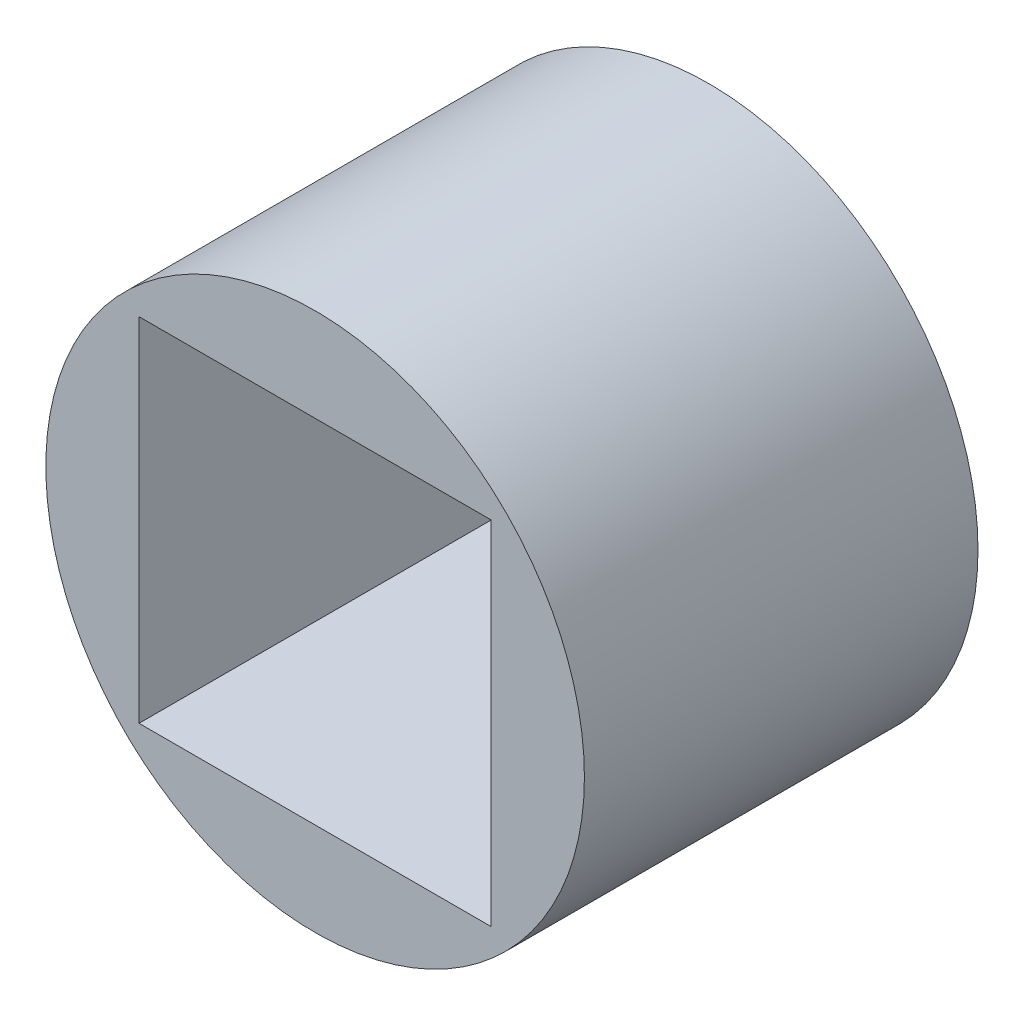
from build123d import *

# Parameters (mm, degrees)
SKETCH1_R           = 13
BOSS_EXTRUDE1_DEPTH = 19
SKETCH2_W           = 17
SKETCH2_H           = 17
CUT_EXTRUDE1_DEPTH  = 27.438608133
SKETCH3_W           = 1.141769493
SKETCH3_H           = 0.590570428
CUT_EXTRUDE2_DEPTH  = 0.25


with BuildPart() as part:
    # Sketch1 → Boss-Extrude1 (new body)
    with BuildSketch(Plane.XY):
        Circle(SKETCH1_R)
    extrude(amount=BOSS_EXTRUDE1_DEPTH)

    # Sketch2 → Cut-Extrude1 (cut, through all)
    with BuildSketch(Plane(origin=(0, 0, 0), x_dir=(-1, 0, 0), z_dir=(0, 0, -1))):
        Rectangle(SKETCH2_W, SKETCH2_H)
    extrude(amount=-CUT_EXTRUDE1_DEPTH, mode=Mode.SUBTRACT)

    # Sketch3 → Cut-Extrude2 (cut)
    with BuildSketch(Plane.XZ.offset(-8.5)):
        with BuildLine():
            Line((-2.812211455, 9.352253877), (-3.678381415, 9.352253877))
            Line((-3.678381415, 9.352253877), (-3.678381415, 9.924368978))
            add(Edge.make_bspline(
                [(-3.678381415, 9.924368978), (-3.678531304, 9.944055381), (-3.678817059, 9.981586333), (-3.680082779, 10.035112211), (-3.681725695, 10.082915251), (-3.684529025, 10.124815355), (-3.689270054, 10.1606206), (-3.692992529, 10.190736926), (-3.698401464, 10.215115406), (-3.706958569, 10.239256452), (-3.722517978, 10.263663704), (-3.750721307, 10.284102994), (-3.787249356, 10.295639991), (-3.814042513, 10.296631897), (-3.828484732, 10.29716656)],
                knots=[0, 0, 0, 0, 1.544726687, 2.944929139, 4.200879413, 5.297955196, 6.23794902, 7.034364875, 7.678368203, 8.192494392, 9.040394705, 9.90282632, 10.869568031, 12, 12, 12, 12], degree=3))
            add(Edge.make_bspline(
                [(-3.828484732, 10.29716656), (-3.844843187, 10.296443751), (-3.875090504, 10.295107254), (-3.915764589, 10.27983069), (-3.947883788, 10.255006405), (-3.963455792, 10.224349752), (-3.9719829, 10.195107964), (-3.978045208, 10.166938862), (-3.982755473, 10.133222048), (-3.98632134, 10.093790582), (-3.989246004, 10.04886429), (-3.99187761, 9.998217535), (-3.992852477, 9.942007394), (-3.993180023, 9.902632614), (-3.99335231, 9.881921729)],
                knots=[0, 0, 0, 0, 1.155598725, 2.136739789, 3.036817958, 3.968349341, 4.516183911, 5.201276685, 6.010136878, 6.931149896, 8.010557147, 9.205355065, 10.530034411, 12, 12, 12, 12], degree=3))
            Line((-3.99335231, 9.881921729), (-3.99335231, 8.29599406))
            add(Edge.make_bspline(
                [(-3.99335231, 8.29599406), (-3.993184001, 8.276103197), (-3.992864703, 8.238368309), (-3.99183693, 8.184210878), (-3.989325666, 8.135606628), (-3.986206822, 8.092131582), (-3.982889448, 8.054311373), (-3.977920802, 8.021650378), (-3.971994017, 7.994499916), (-3.9635188, 7.965970397), (-3.947630874, 7.937002269), (-3.917821907, 7.91210977), (-3.878861591, 7.897821678), (-3.850143573, 7.896322831), (-3.834636507, 7.895513489)],
                knots=[0, 0, 0, 0, 1.468217902, 2.785351057, 3.997700678, 5.059882393, 6.002665009, 6.798968732, 7.496679091, 8.051967021, 8.994385089, 9.885836862, 10.858400762, 12, 12, 12, 12], degree=3))
            add(Edge.make_bspline(
                [(-3.834636507, 7.895513489), (-3.819698183, 7.896211759), (-3.791736081, 7.897518805), (-3.754143957, 7.913645857), (-3.725106356, 7.939886765), (-3.709233303, 7.970279441), (-3.700959446, 8.000878516), (-3.694965817, 8.031116144), (-3.68943821, 8.068045133), (-3.685315484, 8.111581945), (-3.682466643, 8.161863061), (-3.679856272, 8.218662489), (-3.678878645, 8.282457264), (-3.678553123, 8.327163156), (-3.678381415, 8.35074486)],
                knots=[0, 0, 0, 0, 0.994869641, 1.862233423, 2.678863542, 3.569930445, 4.113213846, 4.800007244, 5.633212832, 6.612991899, 7.727492041, 9.005853147, 10.420631309, 12, 12, 12, 12], degree=3))
            Line((-3.678381415, 8.35074486), (-3.678381415, 8.801054811))
            Line((-3.678381415, 8.801054811), (-2.812211455, 8.801054811))
            Line((-2.812211455, 8.801054811), (-2.812211455, 8.666330932))
            add(Edge.make_bspline(
                [(-2.812211455, 8.666330932), (-2.812510297, 8.62326801), (-2.813085292, 8.540411745), (-2.8156951, 8.421006552), (-2.822068007, 8.311491407), (-2.830058093, 8.211608418), (-2.839224244, 8.121179821), (-2.852417278, 8.040605102), (-2.866664952, 7.969590838), (-2.884185653, 7.90701821), (-2.905315501, 7.850175518), (-2.932288177, 7.796788911), (-2.964470261, 7.744978567), (-3.001836158, 7.694509283), (-3.045540248, 7.646169818), (-3.094700764, 7.599745655), (-3.149075965, 7.554634871), (-3.208317302, 7.511859178), (-3.272210595, 7.472300389), (-3.340384896, 7.438052808), (-3.412138069, 7.408898091), (-3.487737308, 7.385573922), (-3.566926614, 7.367322011), (-3.649696742, 7.353667485), (-3.736043377, 7.345538152), (-3.794837463, 7.344727473), (-3.824793667, 7.344314423)],
                knots=[0, 0, 0, 0, 1.60388524, 3.085994514, 4.447560134, 5.688764135, 6.81806339, 7.83131035, 8.728510998, 9.514252572, 10.249013364, 10.983337425, 11.737837366, 12.51836543, 13.318779222, 14.161505663, 15.03472216, 15.948286087, 16.880900769, 17.830405001, 18.786276473, 19.762166314, 20.773656038, 21.810742009, 22.88455005, 24, 24, 24, 24], degree=3))
            add(Edge.make_bspline(
                [(-3.824793667, 7.344314423), (-3.855765717, 7.344880493), (-3.916334777, 7.345987499), (-4.005302226, 7.351905984), (-4.090130839, 7.362974735), (-4.17077051, 7.378512677), (-4.247461921, 7.397114721), (-4.319685464, 7.421460413), (-4.38807136, 7.449538509), (-4.451993186, 7.482146051), (-4.511335401, 7.518435068), (-4.565409343, 7.558420271), (-4.614637079, 7.601471669), (-4.657363395, 7.648835499), (-4.697053663, 7.697957478), (-4.730011496, 7.751705024), (-4.75772854, 7.808667973), (-4.781143666, 7.869514239), (-4.798914432, 7.936356158), (-4.81589962, 8.009474909), (-4.829130428, 8.09068548), (-4.83975887, 8.179390774), (-4.849430719, 8.275948574), (-4.855065124, 8.380218191), (-4.858897081, 8.492206394), (-4.85930952, 8.569334196), (-4.85952227, 8.609119422)],
                knots=[0, 0, 0, 0, 1.164709882, 2.277711161, 3.350788139, 4.379106601, 5.364647481, 6.315587438, 7.242048065, 8.142077566, 9.010916049, 9.854478855, 10.668340489, 11.465036737, 12.250194495, 13.039731894, 13.829419881, 14.629912956, 15.486762133, 16.427645602, 17.451879913, 18.578499397, 19.78690161, 21.099970427, 22.504063026, 24, 24, 24, 24], degree=3))
            Line((-4.85952227, 8.609119422), (-4.85952227, 9.591557935))
            add(Edge.make_bspline(
                [(-4.85952227, 9.591557935), (-4.859364655, 9.620881763), (-4.859059333, 9.677686251), (-4.85784101, 9.760124237), (-4.855967705, 9.836817416), (-4.853773306, 9.90779607), (-4.849911528, 9.972996524), (-4.845720767, 10.032684753), (-4.840787241, 10.08662605), (-4.833841217, 10.151242021), (-4.818559485, 10.227941994), (-4.786866808, 10.316723397), (-4.744327573, 10.404196459), (-4.68878149, 10.488532295), (-4.622402118, 10.569020048), (-4.542038849, 10.639795599), (-4.450450177, 10.701923905), (-4.347746261, 10.754432391), (-4.235187457, 10.79695578), (-4.113572327, 10.826932083), (-3.984046111, 10.844868712), (-3.894982136, 10.847181819), (-3.849400768, 10.848365626)],
                knots=[0, 0, 0, 0, 0.937542307, 1.816154821, 2.635900757, 3.390305849, 4.086362694, 4.723956183, 5.303270312, 5.818037384, 6.801645988, 7.794821725, 8.823980059, 9.904122776, 11.016359314, 12.149366721, 13.314966876, 14.546480666, 15.828692965, 17.153231992, 18.543074481, 20, 20, 20, 20], degree=3))
            add(Edge.make_bspline(
                [(-3.849400768, 10.848365626), (-3.818218399, 10.847874946), (-3.757214543, 10.846915002), (-3.667692998, 10.839935855), (-3.58218135, 10.829184667), (-3.500730926, 10.813323118), (-3.423865076, 10.792078481), (-3.350801704, 10.767862434), (-3.282117239, 10.738105974), (-3.217960547, 10.703759739), (-3.158548438, 10.666275331), (-3.103663575, 10.626891349), (-3.054965395, 10.584407736), (-3.01037431, 10.540693049), (-2.9724161, 10.493795693), (-2.939496627, 10.444785568), (-2.911506085, 10.393656026), (-2.889272659, 10.33900267), (-2.870546624, 10.279725856), (-2.854622531, 10.213971512), (-2.842254411, 10.140499615), (-2.830969979, 10.059709508), (-2.822617123, 9.971237658), (-2.81656143, 9.875224941), (-2.812857701, 9.77183404), (-2.812431726, 9.700447512), (-2.812211455, 9.663533706)],
                knots=[0, 0, 0, 0, 1.221125361, 2.388957573, 3.514579002, 4.595031365, 5.635371264, 6.6359889, 7.607201422, 8.562883183, 9.483118081, 10.356978739, 11.205412399, 12.011792278, 12.79947963, 13.563474823, 14.321707769, 15.07785385, 15.870276022, 16.754591466, 17.72504, 18.786977982, 19.948885868, 21.204283757, 22.55434172, 24, 24, 24, 24], degree=3))
            Line((-2.812211455, 9.663533706), (-2.812211455, 9.352253877))
        make_face()
        with BuildLine():
            Line((-0.607415193, 9.745967495), (-1.434213791, 9.745967495))
            Line((-1.434213791, 9.745967495), (-1.434213791, 10.010493832))
            add(Edge.make_bspline(
                [(-1.434213791, 10.010493832), (-1.434424342, 10.038600943), (-1.434803075, 10.089159178), (-1.440572454, 10.156712144), (-1.449852717, 10.207917942), (-1.464493563, 10.244848093), (-1.485680027, 10.26960077), (-1.511780889, 10.285583326), (-1.543166601, 10.295993716), (-1.565972956, 10.296757981), (-1.578165333, 10.29716656)],
                knots=[0, 0, 0, 0, 1.836110675, 3.302741208, 4.424827114, 5.228882099, 5.865443011, 6.515953015, 7.206622017, 8, 8, 8, 8], degree=3))
            add(Edge.make_bspline(
                [(-1.578165333, 10.29716656), (-1.59139023, 10.296367592), (-1.61682992, 10.29483068), (-1.652696914, 10.282142979), (-1.683004159, 10.260357777), (-1.708227101, 10.230460891), (-1.727398177, 10.191898722), (-1.73933196, 10.14474696), (-1.748480525, 10.089790212), (-1.748939679, 10.050118303), (-1.749184686, 10.028949158)],
                knots=[0, 0, 0, 0, 0.882142373, 1.69690771, 2.502869523, 3.348502484, 4.286047481, 5.353202765, 6.587654712, 8, 8, 8, 8], degree=3))
            add(Edge.make_bspline(
                [(-1.749184686, 10.028949158), (-1.748875663, 10.001640798), (-1.748297859, 9.950580296), (-1.739965657, 9.879472509), (-1.728548474, 9.81841716), (-1.714032595, 9.783124611), (-1.707352614, 9.766883531)],
                knots=[0, 0, 0, 0, 1.225069666, 2.290605275, 3.213363216, 4, 4, 4, 4], degree=3))
            add(Edge.make_bspline(
                [(-1.707352614, 9.766883531), (-1.703230589, 9.759382864), (-1.694380821, 9.743279333), (-1.675956221, 9.719896246), (-1.652544066, 9.695086717), (-1.622849008, 9.670567249), (-1.588601328, 9.644183137), (-1.548684352, 9.617373951), (-1.503064301, 9.589916533), (-1.470757821, 9.571591753), (-1.453899472, 9.562029414)],
                knots=[0, 0, 0, 0, 0.621359025, 1.334024637, 2.156579786, 3.097725489, 4.129453258, 5.299675385, 6.590901449, 8, 8, 8, 8], degree=3))
            add(Edge.make_bspline(
                [(-1.453899472, 9.562029414), (-1.405163578, 9.534790418), (-1.311790998, 9.482603518), (-1.179915837, 9.403910821), (-1.062399055, 9.328610833), (-0.95936084, 9.256343202), (-0.869782603, 9.188786152), (-0.795181648, 9.123703155), (-0.732787028, 9.063836262), (-0.700473322, 9.021270324), (-0.685542739, 9.001602685)],
                knots=[0, 0, 0, 0, 1.399987978, 2.682222047, 3.850399669, 4.898912503, 5.837908684, 6.661707281, 7.381640388, 8, 8, 8, 8], degree=3))
            add(Edge.make_bspline(
                [(-0.685542739, 9.001602685), (-0.672750086, 8.981783618), (-0.646210231, 8.940666646), (-0.614771129, 8.871195556), (-0.588420949, 8.793399931), (-0.566499484, 8.707419905), (-0.549355234, 8.612654358), (-0.537421461, 8.509506908), (-0.52994214, 8.397814001), (-0.529105797, 8.320613766), (-0.528672469, 8.280614622)],
                knots=[0, 0, 0, 0, 0.755791031, 1.567976878, 2.437427939, 3.388209073, 4.411251956, 5.524044322, 6.717152777, 8, 8, 8, 8], degree=3))
            add(Edge.make_bspline(
                [(-0.528672469, 8.280614622), (-0.528836105, 8.251489991), (-0.529153202, 8.19505161), (-0.533635356, 8.113389025), (-0.540295169, 8.037665888), (-0.549167522, 7.967976007), (-0.561618355, 7.904358067), (-0.57614189, 7.846557229), (-0.593239719, 7.794371064), (-0.613663668, 7.747504186), (-0.638242739, 7.704617901), (-0.66757547, 7.664436419), (-0.701406616, 7.625597141), (-0.740435562, 7.588667706), (-0.784370518, 7.5533494), (-0.83362668, 7.520505539), (-0.88766466, 7.488906282), (-0.966591845, 7.448467256), (-1.074312979, 7.406559346), (-1.212910194, 7.369969764), (-1.361567209, 7.348486602), (-1.464082217, 7.345728607), (-1.51664758, 7.344314423)],
                knots=[0, 0, 0, 0, 1.107497416, 2.146134036, 3.109178252, 3.99813931, 4.816387854, 5.572963339, 6.263472328, 6.90247397, 7.5137991, 8.139334416, 8.791524392, 9.46999425, 10.180043659, 10.932750816, 11.71920202, 12.559741855, 14.303331118, 16.1022349, 18.001390822, 20, 20, 20, 20], degree=3))
            add(Edge.make_bspline(
                [(-1.51664758, 7.344314423), (-1.5459883, 7.344532234), (-1.603522919, 7.344959341), (-1.68806542, 7.352348104), (-1.76926082, 7.362334851), (-1.847287922, 7.377341397), (-1.922186408, 7.396077247), (-1.993708317, 7.419847645), (-2.062364395, 7.446405236), (-2.126559463, 7.47867013), (-2.186785674, 7.513556812), (-2.242046333, 7.5507655), (-2.291775859, 7.590539938), (-2.336264103, 7.632280292), (-2.375349746, 7.676698574), (-2.408421301, 7.723792275), (-2.437398806, 7.772332937), (-2.459558961, 7.824736731), (-2.477826886, 7.880644431), (-2.494190304, 7.941340391), (-2.50638253, 8.007693067), (-2.517810224, 8.079426346), (-2.526125958, 8.156633598), (-2.532245965, 8.239316046), (-2.53595608, 8.327334161), (-2.536388963, 8.387856936), (-2.536611922, 8.419029566)],
                knots=[0, 0, 0, 0, 1.22569019, 2.403472703, 3.543972426, 4.643126245, 5.721812748, 6.767838212, 7.791044494, 8.795125093, 9.766644267, 10.698344559, 11.576276872, 12.424947852, 13.244791156, 14.04372162, 14.827104947, 15.60238474, 16.415346987, 17.284198737, 18.22702467, 19.232968501, 20.319354312, 21.470843584, 22.697342326, 24, 24, 24, 24], degree=3))
            Line((-2.536611922, 8.419029566), (-2.536611922, 8.643569364))
            Line((-2.536611922, 8.643569364), (-1.709813324, 8.643569364))
            Line((-1.709813324, 8.643569364), (-1.709813324, 8.209869206))
            add(Edge.make_bspline(
                [(-1.709813324, 8.209869206), (-1.709738101, 8.193870181), (-1.709595315, 8.163501058), (-1.707389879, 8.120252668), (-1.705590689, 8.081374536), (-1.700759859, 8.047007198), (-1.696616133, 8.0167804), (-1.689444736, 7.991455911), (-1.682449935, 7.97021013), (-1.671134676, 7.947994994), (-1.651720908, 7.926094711), (-1.621345234, 7.907587628), (-1.583713707, 7.897388113), (-1.556491772, 7.896168557), (-1.541869859, 7.895513489)],
                knots=[0, 0, 0, 0, 1.399964175, 2.657392233, 3.790316277, 4.803157454, 5.694193129, 6.456033573, 7.103114065, 7.648944185, 8.628154654, 9.619298185, 10.721236556, 12, 12, 12, 12], degree=3))
            add(Edge.make_bspline(
                [(-1.541869859, 7.895513489), (-1.526969755, 7.896162409), (-1.498519082, 7.897401474), (-1.45931763, 7.911709084), (-1.425659067, 7.933701259), (-1.399604277, 7.966044901), (-1.378995018, 8.006392108), (-1.365764676, 8.055401205), (-1.356979046, 8.112356191), (-1.35599693, 8.153027226), (-1.355471067, 8.174804087)],
                knots=[0, 0, 0, 0, 0.935550044, 1.786365327, 2.59701399, 3.441515158, 4.372764623, 5.436873315, 6.627601813, 8, 8, 8, 8], degree=3))
            add(Edge.make_bspline(
                [(-1.355471067, 8.174804087), (-1.355680186, 8.199007417), (-1.356080968, 8.245393919), (-1.359824317, 8.311678866), (-1.365523379, 8.371740816), (-1.374946066, 8.424843235), (-1.385464604, 8.471833003), (-1.399837021, 8.511580411), (-1.415199731, 8.54599812), (-1.429359619, 8.564625597), (-1.436059324, 8.573439125)],
                knots=[0, 0, 0, 0, 1.405345699, 2.693392728, 3.854590553, 4.905871976, 5.824333091, 6.645380771, 7.359066403, 8, 8, 8, 8], degree=3))
            add(Edge.make_bspline(
                [(-1.436059324, 8.573439125), (-1.444127574, 8.58198508), (-1.462279598, 8.60121185), (-1.49575473, 8.629604242), (-1.53741127, 8.661465739), (-1.586310169, 8.697830439), (-1.643955449, 8.737127162), (-1.709530413, 8.780082178), (-1.783834858, 8.826209228), (-1.836107125, 8.858098881), (-1.863607706, 8.874876114)],
                knots=[0, 0, 0, 0, 0.537557046, 1.209400947, 2.005333879, 2.938205525, 3.997682112, 5.197642862, 6.525672313, 8, 8, 8, 8], degree=3))
            add(Edge.make_bspline(
                [(-1.863607706, 8.874876114), (-1.891119812, 8.891635381), (-1.944045144, 8.923875361), (-2.01935485, 8.970966718), (-2.087448302, 9.014845361), (-2.147840291, 9.05519791), (-2.201345258, 9.091647275), (-2.247248583, 9.124729926), (-2.286309126, 9.154116628), (-2.328658833, 9.189501052), (-2.374427666, 9.236661055), (-2.423194058, 9.300414911), (-2.466753258, 9.373632736), (-2.505945393, 9.456076104), (-2.53845555, 9.549441452), (-2.559391283, 9.655214113), (-2.574238046, 9.772205557), (-2.575384619, 9.854389875), (-2.575983284, 9.897301167)],
                knots=[0, 0, 0, 0, 1.160229675, 2.231946262, 3.19886387, 4.077597015, 4.847836815, 5.530373113, 6.115310034, 6.607974679, 7.516703557, 8.475378429, 9.492441335, 10.579318754, 11.758781032, 13.042133943, 14.455595244, 16, 16, 16, 16], degree=3))
            add(Edge.make_bspline(
                [(-2.575983284, 9.897301167), (-2.575530504, 9.928677824), (-2.574657068, 9.989205059), (-2.570772683, 10.076682019), (-2.562631108, 10.157538996), (-2.551850764, 10.231923738), (-2.537656978, 10.299914369), (-2.520931923, 10.361643502), (-2.49985654, 10.416439591), (-2.476240257, 10.465587933), (-2.448667008, 10.510030229), (-2.417037923, 10.550952106), (-2.382557722, 10.590514278), (-2.342981715, 10.626245087), (-2.300160494, 10.660515503), (-2.253640782, 10.692458171), (-2.202839579, 10.721266919), (-2.129417667, 10.757221209), (-2.028783893, 10.794181), (-1.897815022, 10.82615824), (-1.755283469, 10.845247236), (-1.656352854, 10.847303241), (-1.605233144, 10.848365626)],
                knots=[0, 0, 0, 0, 1.193273294, 2.301887419, 3.328400059, 4.282301227, 5.158594548, 5.968352012, 6.711261984, 7.387819659, 8.039147108, 8.695727846, 9.353002766, 10.031758738, 10.719812256, 11.437875913, 12.174869463, 12.938603669, 14.544867531, 16.239404325, 18.056814251, 20, 20, 20, 20], degree=3))
            add(Edge.make_bspline(
                [(-1.605233144, 10.848365626), (-1.576727211, 10.84793803), (-1.520698217, 10.847097581), (-1.43829186, 10.842661455), (-1.359419195, 10.832706521), (-1.28342725, 10.82182868), (-1.210901006, 10.805318472), (-1.141308882, 10.786663991), (-1.075153782, 10.763761818), (-1.012645137, 10.737294873), (-0.954217859, 10.708588161), (-0.900019642, 10.678848557), (-0.852233523, 10.64551897), (-0.807877085, 10.612556671), (-0.770638736, 10.575379423), (-0.736620565, 10.538205784), (-0.709152074, 10.498047179), (-0.686041307, 10.455435184), (-0.667697988, 10.407925759), (-0.650934487, 10.354607786), (-0.637920951, 10.293553454), (-0.625979301, 10.225498501), (-0.6178255, 10.149653688), (-0.611725108, 10.066559317), (-0.608056842, 9.976076437), (-0.607634543, 9.913299144), (-0.607415193, 9.880691374)],
                knots=[0, 0, 0, 0, 1.258665126, 2.473932015, 3.640650328, 4.767380648, 5.861263212, 6.922053515, 7.947007588, 8.949117803, 9.916776883, 10.82072156, 11.674447384, 12.487508854, 13.255791159, 13.993321992, 14.70902737, 15.397593972, 16.128875377, 16.95354688, 17.862825142, 18.882327294, 20.003040562, 21.228548882, 22.560453324, 24, 24, 24, 24], degree=3))
            Line((-0.607415193, 9.880691374), (-0.607415193, 9.745967495))
        make_face()
        with BuildLine():
            Line((1.597381069, 9.745967495), (0.770582471, 9.745967495))
            Line((0.770582471, 9.745967495), (0.770582471, 10.010493832))
            add(Edge.make_bspline(
                [(0.770582471, 10.010493832), (0.77037192, 10.038600943), (0.769993187, 10.089159178), (0.764223808, 10.156712144), (0.754943545, 10.207917942), (0.740302699, 10.244848093), (0.719116236, 10.26960077), (0.693015373, 10.285583326), (0.661629661, 10.295993716), (0.638823306, 10.296757981), (0.626630929, 10.29716656)],
                knots=[0, 0, 0, 0, 1.836110675, 3.302741208, 4.424827114, 5.228882099, 5.865443011, 6.515953015, 7.206622017, 8, 8, 8, 8], degree=3))
            add(Edge.make_bspline(
                [(0.626630929, 10.29716656), (0.613406033, 10.296367592), (0.587966342, 10.29483068), (0.552099348, 10.282142979), (0.521792103, 10.260357777), (0.496569161, 10.230460891), (0.477398085, 10.191898722), (0.465464302, 10.14474696), (0.456315737, 10.089790212), (0.455856583, 10.050118303), (0.455611577, 10.028949158)],
                knots=[0, 0, 0, 0, 0.882142373, 1.69690771, 2.502869523, 3.348502484, 4.286047481, 5.353202765, 6.587654712, 8, 8, 8, 8], degree=3))
            add(Edge.make_bspline(
                [(0.455611577, 10.028949158), (0.4559206, 10.001640798), (0.456498404, 9.950580296), (0.464830605, 9.879472509), (0.476247788, 9.81841716), (0.490763667, 9.783124611), (0.497443648, 9.766883531)],
                knots=[0, 0, 0, 0, 1.225069666, 2.290605275, 3.213363216, 4, 4, 4, 4], degree=3))
            add(Edge.make_bspline(
                [(0.497443648, 9.766883531), (0.501565674, 9.759382864), (0.510415442, 9.743279333), (0.528840041, 9.719896246), (0.552252196, 9.695086717), (0.581947254, 9.670567249), (0.616194934, 9.644183137), (0.65611191, 9.617373951), (0.701731961, 9.589916533), (0.734038441, 9.571591753), (0.75089679, 9.562029414)],
                knots=[0, 0, 0, 0, 0.621359025, 1.334024637, 2.156579786, 3.097725489, 4.129453258, 5.299675385, 6.590901449, 8, 8, 8, 8], degree=3))
            add(Edge.make_bspline(
                [(0.75089679, 9.562029414), (0.799632684, 9.534790418), (0.893005265, 9.482603518), (1.024880425, 9.403910821), (1.142397208, 9.328610833), (1.245435422, 9.256343202), (1.33501366, 9.188786152), (1.409614614, 9.123703155), (1.472009234, 9.063836262), (1.50432294, 9.021270324), (1.519253523, 9.001602685)],
                knots=[0, 0, 0, 0, 1.399987978, 2.682222047, 3.850399669, 4.898912503, 5.837908684, 6.661707281, 7.381640388, 8, 8, 8, 8], degree=3))
            add(Edge.make_bspline(
                [(1.519253523, 9.001602685), (1.532046177, 8.981783618), (1.558586032, 8.940666646), (1.590025134, 8.871195556), (1.616375314, 8.793399931), (1.638296778, 8.707419905), (1.655441028, 8.612654358), (1.667374801, 8.509506908), (1.674854123, 8.397814001), (1.675690465, 8.320613766), (1.676123793, 8.280614622)],
                knots=[0, 0, 0, 0, 0.755791031, 1.567976878, 2.437427939, 3.388209073, 4.411251956, 5.524044322, 6.717152777, 8, 8, 8, 8], degree=3))
            add(Edge.make_bspline(
                [(1.676123793, 8.280614622), (1.675960157, 8.251489991), (1.67564306, 8.19505161), (1.671160906, 8.113389025), (1.664501093, 8.037665888), (1.65562874, 7.967976007), (1.643177907, 7.904358067), (1.628654373, 7.846557229), (1.611556544, 7.794371064), (1.591132594, 7.747504186), (1.566553523, 7.704617901), (1.537220792, 7.664436419), (1.503389646, 7.625597141), (1.4643607, 7.588667706), (1.420425745, 7.5533494), (1.371169583, 7.520505539), (1.317131602, 7.488906282), (1.238204417, 7.448467256), (1.130483283, 7.406559346), (0.991886069, 7.369969764), (0.843229053, 7.348486602), (0.740714045, 7.345728607), (0.688148682, 7.344314423)],
                knots=[0, 0, 0, 0, 1.107497416, 2.146134036, 3.109178252, 3.99813931, 4.816387854, 5.572963339, 6.263472328, 6.90247397, 7.5137991, 8.139334416, 8.791524392, 9.46999425, 10.180043659, 10.932750816, 11.71920202, 12.559741855, 14.303331118, 16.1022349, 18.001390822, 20, 20, 20, 20], degree=3))
            add(Edge.make_bspline(
                [(0.688148682, 7.344314423), (0.658807963, 7.344532234), (0.601273343, 7.344959341), (0.516730842, 7.352348104), (0.435535442, 7.362334851), (0.35750834, 7.377341397), (0.282609855, 7.396077247), (0.211087946, 7.419847645), (0.142431867, 7.446405236), (0.0782368, 7.47867013), (0.018010589, 7.513556812), (-0.037250071, 7.5507655), (-0.086979596, 7.590539938), (-0.131467841, 7.632280292), (-0.170553484, 7.676698574), (-0.203625039, 7.723792275), (-0.232602544, 7.772332937), (-0.254762699, 7.824736731), (-0.273030624, 7.880644431), (-0.289394042, 7.941340391), (-0.301586267, 8.007693067), (-0.313013962, 8.079426346), (-0.321329696, 8.156633598), (-0.327449702, 8.239316046), (-0.331159817, 8.327334161), (-0.331592701, 8.387856936), (-0.33181566, 8.419029566)],
                knots=[0, 0, 0, 0, 1.22569019, 2.403472703, 3.543972426, 4.643126245, 5.721812748, 6.767838212, 7.791044494, 8.795125093, 9.766644267, 10.698344559, 11.576276872, 12.424947852, 13.244791156, 14.04372162, 14.827104947, 15.60238474, 16.415346987, 17.284198737, 18.22702467, 19.232968501, 20.319354312, 21.470843584, 22.697342326, 24, 24, 24, 24], degree=3))
            Line((-0.33181566, 8.419029566), (-0.33181566, 8.643569364))
            Line((-0.33181566, 8.643569364), (0.494982938, 8.643569364))
            Line((0.494982938, 8.643569364), (0.494982938, 8.209869206))
            add(Edge.make_bspline(
                [(0.494982938, 8.209869206), (0.495058161, 8.193870181), (0.495200948, 8.163501058), (0.497406383, 8.120252668), (0.499205573, 8.081374536), (0.504036404, 8.047007198), (0.508180129, 8.0167804), (0.515351526, 7.991455911), (0.522346328, 7.97021013), (0.533661586, 7.947994994), (0.553075354, 7.926094711), (0.583451028, 7.907587628), (0.621082555, 7.897388113), (0.64830449, 7.896168557), (0.662926404, 7.895513489)],
                knots=[0, 0, 0, 0, 1.399964175, 2.657392233, 3.790316277, 4.803157454, 5.694193129, 6.456033573, 7.103114065, 7.648944185, 8.628154654, 9.619298185, 10.721236556, 12, 12, 12, 12], degree=3))
            add(Edge.make_bspline(
                [(0.662926404, 7.895513489), (0.677826507, 7.896162409), (0.70627718, 7.897401474), (0.745478632, 7.911709084), (0.779137195, 7.933701259), (0.805191985, 7.966044901), (0.825801244, 8.006392108), (0.839031586, 8.055401205), (0.847817216, 8.112356191), (0.848799332, 8.153027226), (0.849325195, 8.174804087)],
                knots=[0, 0, 0, 0, 0.935550044, 1.786365327, 2.59701399, 3.441515158, 4.372764623, 5.436873315, 6.627601813, 8, 8, 8, 8], degree=3))
            add(Edge.make_bspline(
                [(0.849325195, 8.174804087), (0.849116076, 8.199007417), (0.848715294, 8.245393919), (0.844971945, 8.311678866), (0.839272883, 8.371740816), (0.829850196, 8.424843235), (0.819331658, 8.471833003), (0.804959242, 8.511580411), (0.789596531, 8.54599812), (0.775436643, 8.564625597), (0.768736939, 8.573439125)],
                knots=[0, 0, 0, 0, 1.405345699, 2.693392728, 3.854590553, 4.905871976, 5.824333091, 6.645380771, 7.359066403, 8, 8, 8, 8], degree=3))
            add(Edge.make_bspline(
                [(0.768736939, 8.573439125), (0.760668689, 8.58198508), (0.742516664, 8.60121185), (0.709041532, 8.629604242), (0.667384992, 8.661465739), (0.618486093, 8.697830439), (0.560840813, 8.737127162), (0.49526585, 8.780082178), (0.420961404, 8.826209228), (0.368689138, 8.858098881), (0.341188556, 8.874876114)],
                knots=[0, 0, 0, 0, 0.537557046, 1.209400947, 2.005333879, 2.938205525, 3.997682112, 5.197642862, 6.525672313, 8, 8, 8, 8], degree=3))
            add(Edge.make_bspline(
                [(0.341188556, 8.874876114), (0.313676451, 8.891635381), (0.260751118, 8.923875361), (0.185441412, 8.970966718), (0.11734796, 9.014845361), (0.056955972, 9.05519791), (0.003451004, 9.091647275), (-0.042452321, 9.124729926), (-0.081512864, 9.154116628), (-0.123862571, 9.189501052), (-0.169631404, 9.236661055), (-0.218397796, 9.300414911), (-0.261956996, 9.373632736), (-0.301149131, 9.456076104), (-0.333659288, 9.549441452), (-0.354595021, 9.655214113), (-0.369441784, 9.772205557), (-0.370588357, 9.854389875), (-0.371187022, 9.897301167)],
                knots=[0, 0, 0, 0, 1.160229675, 2.231946262, 3.19886387, 4.077597015, 4.847836815, 5.530373113, 6.115310034, 6.607974679, 7.516703557, 8.475378429, 9.492441335, 10.579318754, 11.758781032, 13.042133943, 14.455595244, 16, 16, 16, 16], degree=3))
            add(Edge.make_bspline(
                [(-0.371187022, 9.897301167), (-0.370734242, 9.928677824), (-0.369860806, 9.989205059), (-0.365976421, 10.076682019), (-0.357834846, 10.157538996), (-0.347054502, 10.231923738), (-0.332860716, 10.299914369), (-0.316135661, 10.361643502), (-0.295060278, 10.416439591), (-0.271443994, 10.465587933), (-0.243870746, 10.510030229), (-0.21224166, 10.550952106), (-0.17776146, 10.590514278), (-0.138185453, 10.626245087), (-0.095364232, 10.660515503), (-0.04884452, 10.692458171), (0.001956684, 10.721266919), (0.075378595, 10.757221209), (0.176012369, 10.794181), (0.30698124, 10.82615824), (0.449512793, 10.845247236), (0.548443408, 10.847303241), (0.599563118, 10.848365626)],
                knots=[0, 0, 0, 0, 1.193273294, 2.301887419, 3.328400059, 4.282301227, 5.158594548, 5.968352012, 6.711261984, 7.387819659, 8.039147108, 8.695727846, 9.353002766, 10.031758738, 10.719812256, 11.437875913, 12.174869463, 12.938603669, 14.544867531, 16.239404325, 18.056814251, 20, 20, 20, 20], degree=3))
            add(Edge.make_bspline(
                [(0.599563118, 10.848365626), (0.628069051, 10.84793803), (0.684098045, 10.847097581), (0.766504402, 10.842661455), (0.845377068, 10.832706521), (0.921369012, 10.82182868), (0.993895256, 10.805318472), (1.06348738, 10.786663991), (1.12964248, 10.763761818), (1.192151125, 10.737294873), (1.250578403, 10.708588161), (1.30477662, 10.678848557), (1.352562739, 10.64551897), (1.396919177, 10.612556671), (1.434157527, 10.575379423), (1.468175697, 10.538205784), (1.495644188, 10.498047179), (1.518754956, 10.455435184), (1.537098275, 10.407925759), (1.553861776, 10.354607786), (1.566875311, 10.293553454), (1.578816961, 10.225498501), (1.586970762, 10.149653688), (1.593071155, 10.066559317), (1.59673942, 9.976076437), (1.597161719, 9.913299144), (1.597381069, 9.880691374)],
                knots=[0, 0, 0, 0, 1.258665126, 2.473932015, 3.640650328, 4.767380648, 5.861263212, 6.922053515, 7.947007588, 8.949117803, 9.916776883, 10.82072156, 11.674447384, 12.487508854, 13.255791159, 13.993321992, 14.70902737, 15.397593972, 16.128875377, 16.95354688, 17.862825142, 18.882327294, 20.003040562, 21.228548882, 22.560453324, 24, 24, 24, 24], degree=3))
            Line((1.597381069, 9.880691374), (1.597381069, 9.745967495))
        make_face()
        with Locations((2.404493987, 8.820740492)):
            Rectangle(SKETCH3_W, SKETCH3_H)
        with BuildLine():
            Line((4.471490483, 10.769622902), (4.471490483, 7.423057147))
            Line((4.471490483, 7.423057147), (3.644691884, 7.423057147))
            Line((3.644691884, 7.423057147), (3.644691884, 9.203380915))
            add(Edge.make_bspline(
                [(3.644691884, 9.203380915), (3.644832046, 9.233936011), (3.645097332, 9.291768204), (3.643336933, 9.373782363), (3.642737916, 9.446195348), (3.639897452, 9.508928032), (3.637591315, 9.562049099), (3.635027744, 9.605621698), (3.630513409, 9.639420133), (3.625428635, 9.671647762), (3.613672341, 9.704187521), (3.590734561, 9.73718859), (3.558946708, 9.764388581), (3.526387979, 9.783062856), (3.49404996, 9.79514467), (3.46256302, 9.802526681), (3.424918789, 9.810289709), (3.38044831, 9.815307508), (3.329372767, 9.819632125), (3.271716416, 9.822550605), (3.207518311, 9.824408649), (3.162599319, 9.824606397), (3.139015956, 9.824710218)],
                knots=[0, 0, 0, 0, 1.80900232, 3.423931918, 4.856770392, 6.096099685, 7.14135061, 8.005493276, 8.678632328, 9.159696133, 9.935578214, 10.70343964, 11.512067358, 12.393018947, 12.911680779, 13.550668835, 14.305461384, 15.186412973, 16.197689678, 17.340552812, 18.60373737, 20, 20, 20, 20], degree=3))
            Line((3.139015956, 9.824710218), (3.054121457, 9.824710218))
            Line((3.054121457, 9.824710218), (3.054121457, 10.208580996))
            add(Edge.make_bspline(
                [(3.054121457, 10.208580996), (3.102526445, 10.220750378), (3.19730464, 10.244578337), (3.333306474, 10.29239134), (3.460588642, 10.348945999), (3.578881155, 10.4146705), (3.688107456, 10.489606419), (3.788100155, 10.573752214), (3.879939221, 10.666464331), (3.93306761, 10.735209992), (3.959662779, 10.769622902)],
                knots=[0, 0, 0, 0, 1.099490653, 2.152830597, 3.172387781, 4.165697536, 5.130894747, 6.086768832, 7.042268956, 8, 8, 8, 8], degree=3))
            Line((3.959662779, 10.769622902), (4.471490483, 10.769622902))
        make_face()
    extrude(amount=-CUT_EXTRUDE2_DEPTH, mode=Mode.SUBTRACT)


solid = part.part
